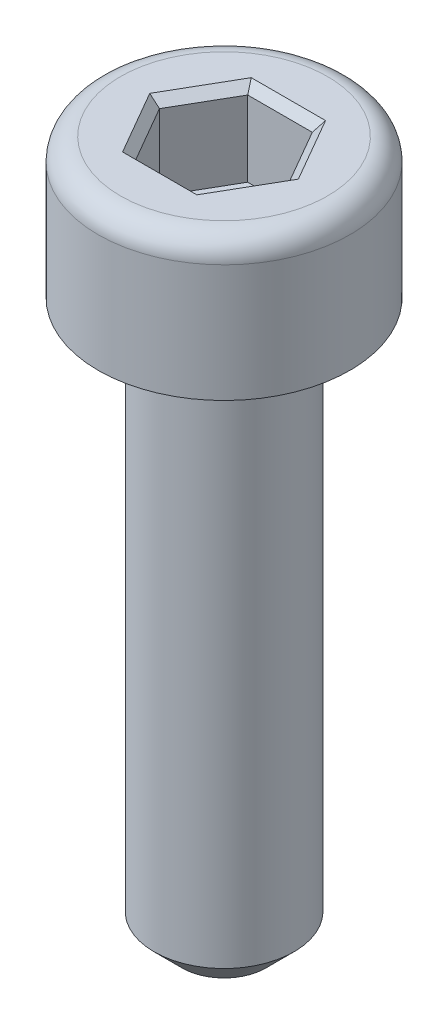
from build123d import *

# Parameters (mm, degrees)
ENL_V_MAT_EXTRU_1_DEPTH = 1.5
CHANFREIN1_SIZE         = 0.15


with BuildPart() as part:
    # Esquisse1 → Révolution1 (revolve)
    with BuildSketch(Plane.XY, mode=Mode.PRIVATE) as r_volution1_sk:
        with BuildLine():
            Line((1.25, -9.5), (0.75, -10))
            Line((0.75, -10), (0, -10))
            Line((0, -10), (0, 2.5))
            Line((0, 2.5), (1.85, 2.5))
            ThreePointArc((1.85, 2.5), (2.132842712, 2.382842712), (2.25, 2.1))
            Line((2.25, 2.1), (2.25, 0))
            Line((2.25, 0), (1.25, 0))
            Line((1.25, 0), (1.25, -9.5))
        make_face()
    revolve(r_volution1_sk.sketch.rotate(Axis((0, 6.972972973, 0), (0, -1, 0)), 90), axis=Axis((0, 6.972972973, 0), (0, -1, 0)))

    # Esquisse2 → Enlèv. mat.-Extru.1 (cut)
    with BuildSketch(Plane(origin=(0, 2.5, 0), x_dir=(1, 0, 0), z_dir=(0, 1, 0))):
        Polygon((-1.154700538, 0), (-0.577350269, -1), (0.577350269, -1), (1.154700538, 0), (0.577350269, 1), (-0.577350269, 1), align=None)
    extrude(amount=-ENL_V_MAT_EXTRU_1_DEPTH, mode=Mode.SUBTRACT)

    # Chanfrein1
    chanfrein1_edges = [part.edges().sort_by_distance(p)[0] for p in [
        (-0.866025404, 2.5, -0.5),
        (-0.866025404, 2.5, 0.5),
        (0, 2.5, 1),
        (0.866025404, 2.5, 0.5),
        (0.866025404, 2.5, -0.5),
        (0, 2.5, -1),
    ]]
    chamfer(chanfrein1_edges, length=CHANFREIN1_SIZE)


solid = part.part
